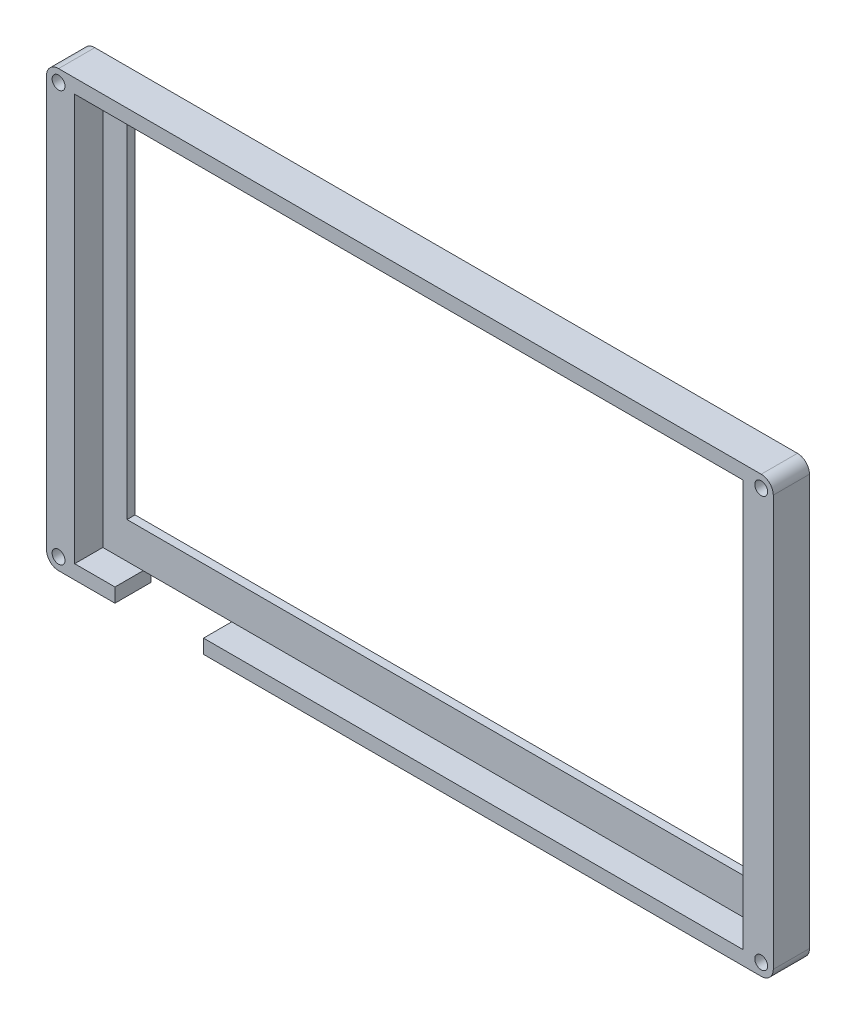
from build123d import *

# Parameters (mm, degrees)
SKETCH_1_R          = 1.6
EXTRUDE_3_DEPTH     = 9
SKETCH_3_W          = 166
SKETCH_3_H          = 101
CUT_EXTRUDE_1_DEPTH = 7
SKETCH_5_W          = 157
SKETCH_5_H          = 88
CUT_EXTRUDE_2_DEPTH = 211.459616079
SKETCH_6_W          = 22
SKETCH_6_H          = 3.5
CUT_EXTRUDE_3_DEPTH = 211.535626439


with BuildPart() as part:
    # 草图1 → 凸台-拉伸3 (new body)
    with BuildSketch(Plane.XY):
        with BuildLine():
            Line((3, 0), (177.5, 0))
            ThreePointArc((177.5, 0), (179.621320344, 0.878679656), (180.5, 3))
            Line((180.5, 3), (180.5, 105))
            ThreePointArc((180.5, 105), (179.621320344, 107.121320344), (177.5, 108))
            Line((177.5, 108), (3, 108))
            ThreePointArc((3, 108), (0.878679656, 107.121320344), (0, 105))
            Line((0, 105), (0, 3))
            ThreePointArc((0, 3), (0.878679656, 0.878679656), (3, 0))
        make_face()
        with Locations((3, 3)):
            Circle(SKETCH_1_R, mode=Mode.SUBTRACT)
        with Locations((3, 105)):
            Circle(SKETCH_1_R, mode=Mode.SUBTRACT)
        with Locations((177.5, 105)):
            Circle(SKETCH_1_R, mode=Mode.SUBTRACT)
        with Locations((177.5, 3)):
            Circle(SKETCH_1_R, mode=Mode.SUBTRACT)
    extrude(amount=EXTRUDE_3_DEPTH)

    # 草图3 → 切除-拉伸1 (cut)
    with BuildSketch(Plane.XY.offset(9)):
        with Locations((90, 54)):
            Rectangle(SKETCH_3_W, SKETCH_3_H)
    extrude(amount=-CUT_EXTRUDE_1_DEPTH, mode=Mode.SUBTRACT)

    # 草图5 → 切除-拉伸2 (cut, through all)
    with BuildSketch(Plane.XY.offset(2)):
        with Locations((91.5, 56.5)):
            Rectangle(SKETCH_5_W, SKETCH_5_H)
    extrude(amount=-CUT_EXTRUDE_2_DEPTH, mode=Mode.SUBTRACT)

    # 草图6 → 切除-拉伸3 (cut, through all)
    with BuildSketch(Plane.XY.offset(9)):
        with Locations((28, 1.75)):
            Rectangle(SKETCH_6_W, SKETCH_6_H)
    extrude(amount=-CUT_EXTRUDE_3_DEPTH, mode=Mode.SUBTRACT)


solid = part.part
